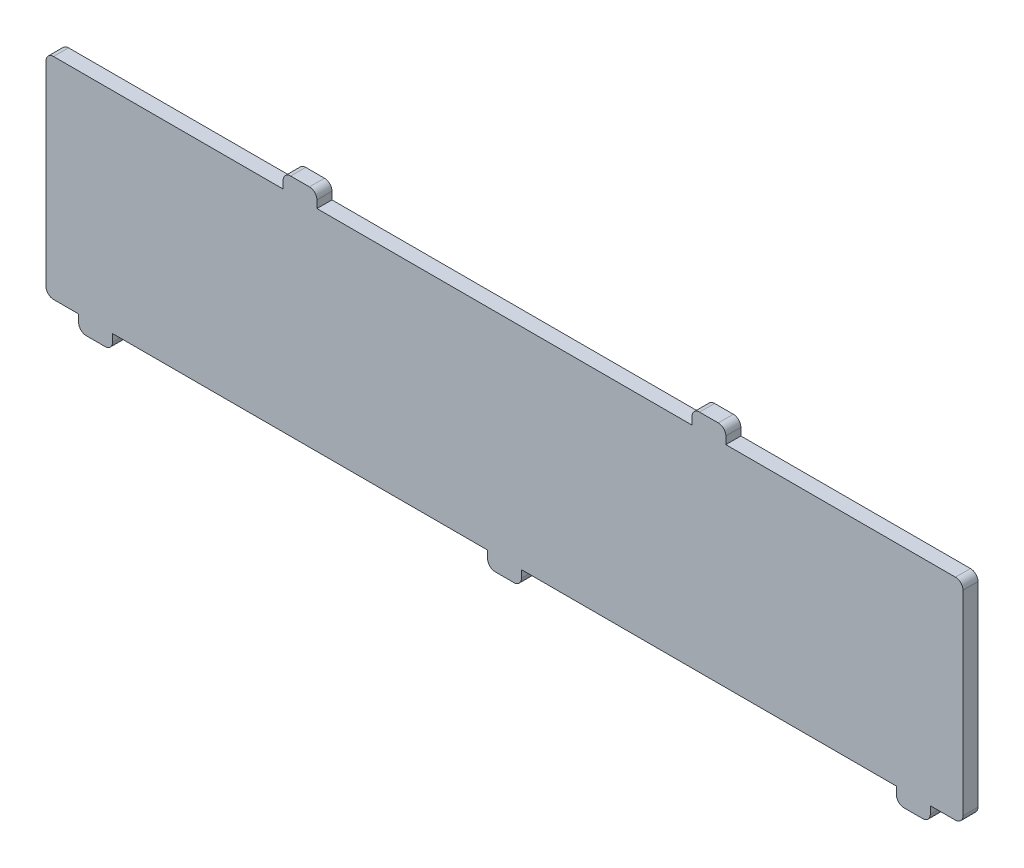
from build123d import *

# Parameters (mm, degrees)
SKETCH1_W           = 122
SKETCH1_H           = 28
SKETCH1_W_2         = 4.5
SKETCH1_H_2         = 2
BOSS_EXTRUDE1_DEPTH = 1
FILLET1_R           = 1


with BuildPart() as part:
    # Sketch1 → Boss-Extrude1 (new, symmetric)
    with BuildSketch(Plane.XY):
        Rectangle(SKETCH1_W, SKETCH1_H)
        with Locations((0, -15)):
            Rectangle(SKETCH1_W_2, SKETCH1_H_2)
        with Locations((27.2, 15)):
            Rectangle(SKETCH1_W_2, SKETCH1_H_2)
        with Locations((-27.2, 15)):
            Rectangle(SKETCH1_W_2, SKETCH1_H_2)
        with Locations((-54.4, -15)):
            Rectangle(SKETCH1_W_2, SKETCH1_H_2)
        with Locations((54.4, -15)):
            Rectangle(SKETCH1_W_2, SKETCH1_H_2)
    extrude(amount=BOSS_EXTRUDE1_DEPTH, both=True)

    # Fillet1
    fillet1_edges = [part.edges().sort_by_distance(p)[0] for p in [
        (61, -14, 0),
        (2.25, -16, 0),
        (-2.25, -16, 0),
        (-61, -14, 0),
        (-61, 14, 0),
        (-29.45, 16, 0),
        (-24.95, 16, 0),
        (24.95, 16, 0),
        (29.45, 16, 0),
        (61, 14, 0),
        (-56.65, -16, 0),
        (-52.15, -16, 0),
        (52.15, -16, 0),
        (56.65, -16, 0),
    ]]
    fillet(fillet1_edges, radius=FILLET1_R)


solid = part.part
